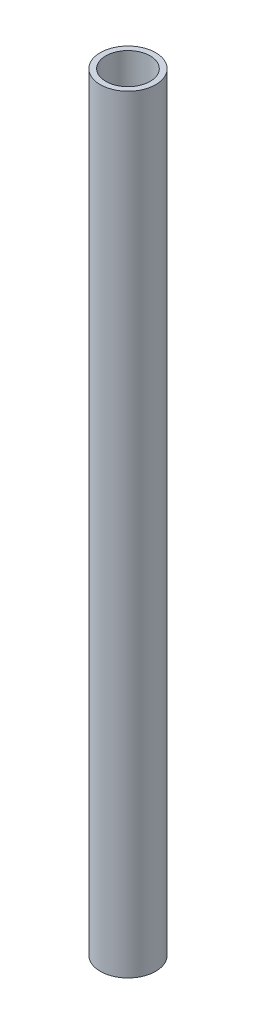
from build123d import *

# Parameters (mm, degrees)
SKETCH1_R           = 1.984375
SKETCH1_R_2         = 1.5875
BOSS_EXTRUDE1_DEPTH = 27.5


with BuildPart() as part:
    # Sketch1 → Boss-Extrude1 (new, symmetric)
    with BuildSketch(Plane(origin=(0, 0, 0), x_dir=(1, 0, 0), z_dir=(0, 1, 0))):
        with Locations(Location((0, 0, 0), (0, 0, 270))):
            Circle(SKETCH1_R)
        with Locations(Location((0, 0, 0), (0, 0, 270))):
            Circle(SKETCH1_R_2, mode=Mode.SUBTRACT)
    extrude(amount=BOSS_EXTRUDE1_DEPTH, both=True)


solid = part.part
